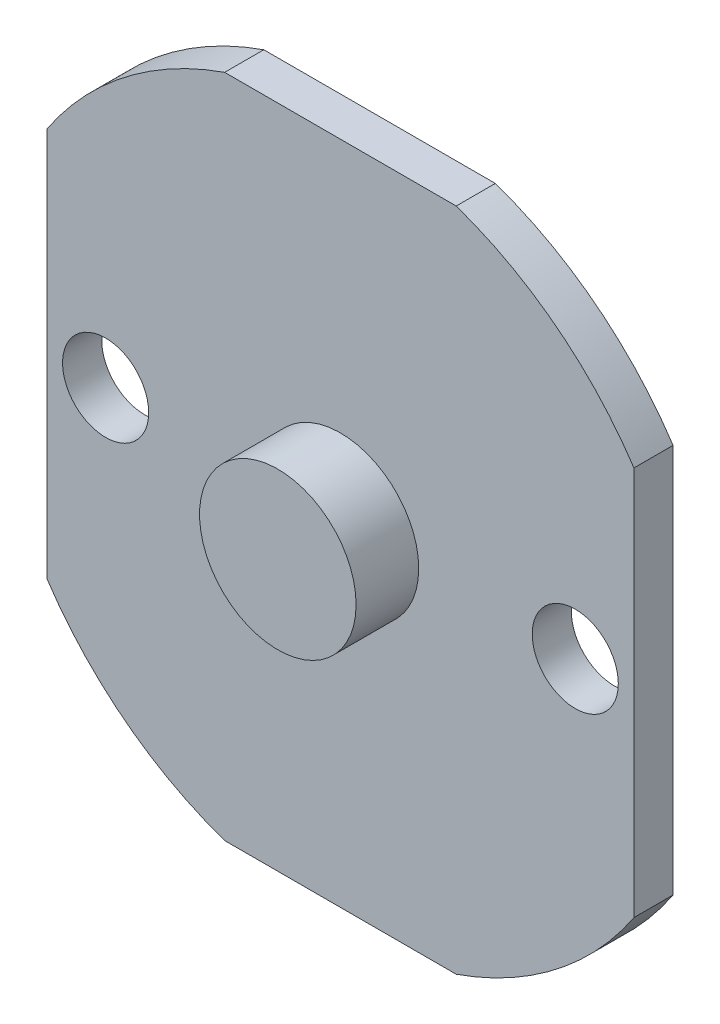
from build123d import *

# Parameters (mm, degrees)
SKETCH_1_R          = 9
SKETCH_1_R_2        = 1.1
EXTRUDE_1_DEPTH     = 1
SKETCH_2_W          = 32.389432278
SKETCH_2_H          = 26.120675296
SKETCH_2_W_2        = 15
SKETCH_2_H_2        = 17
CUT_EXTRUDE_1_DEPTH = 2
SKETCH_3_R          = 2
EXTRUDE_2_DEPTH     = 1.6


with BuildPart() as part:
    # 草图1 → 凸台-拉伸1 (new body)
    with BuildSketch(Plane.XY):
        Circle(SKETCH_1_R)
        with Locations((6, 0)):
            Circle(SKETCH_1_R_2, mode=Mode.SUBTRACT)
        with Locations((-6, 0)):
            Circle(SKETCH_1_R_2, mode=Mode.SUBTRACT)
    extrude(amount=EXTRUDE_1_DEPTH)

    # 草图2 → 切除-拉伸1 (cut)
    with BuildSketch(Plane.XY.offset(1)):
        Rectangle(SKETCH_2_W, SKETCH_2_H)
        Rectangle(SKETCH_2_W_2, SKETCH_2_H_2, mode=Mode.SUBTRACT)
    extrude(amount=-CUT_EXTRUDE_1_DEPTH, mode=Mode.SUBTRACT)

    # 草图3 → 凸台-拉伸2 (add)
    with BuildSketch(Plane.XY.offset(1)):
        Circle(SKETCH_3_R)
    extrude(amount=EXTRUDE_2_DEPTH)


solid = part.part
